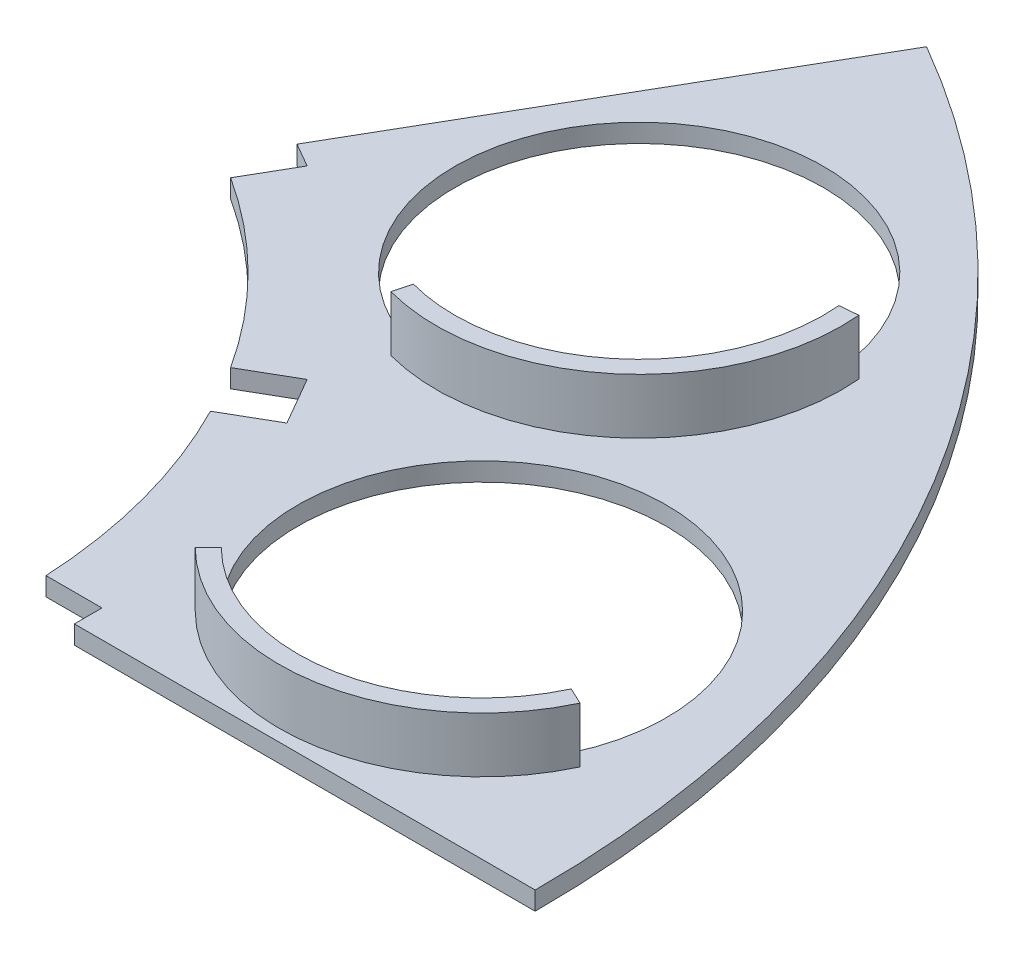
from build123d import *

# Parameters (mm, degrees)
AUFSATZ_LINEAR_AUSTRAGEN1_DEPTH = 5
SKIZZE2_R                       = 50
SCHNITT_LINEAR_AUSTRAGEN1_DEPTH = 384.666521865
AUFSATZ_LINEAR_START            = 15
AUFSATZ_LINEAR_AUSTRAGEN2_DEPTH = 15
SKIZZE4_R                       = 3.6
SCHNITT_LINEAR_AUSTRAGEN2_DEPTH = 4.4
SCHNITT_LINEAR_AUSTRAGEN3_DEPTH = 384.927076409


with BuildPart() as part:
    # Skizze1 → Aufsatz-Linear austragen1 (new body)
    with BuildSketch(Plane(origin=(0, 0, 0), x_dir=(1, 0, 0), z_dir=(0, 1, 0))):
        with BuildLine():
            Line((150, 0), (290, 0))
            ThreePointArc((290, 0), (251.147367097, 145), (145, 251.147367097))
            Line((145, 251.147367097), (75, 129.903810568))
            ThreePointArc((75, 129.903810568), (129.903810568, 75), (150, 0))
        make_face()
    extrude(amount=AUFSATZ_LINEAR_AUSTRAGEN1_DEPTH)

    # Skizze2 → Schnitt-Linear austragen1 (cut, through all)
    with BuildSketch(Plane(origin=(0, 5, 0), x_dir=(1, 0, 0), z_dir=(0, 1, 0))):
        with Locations(Location((217.333310915, 58.234285148, 0), (0, 0, 270))):
            Circle(SKIZZE2_R)
        with Locations(Location((159.099025767, 159.099025767, 0), (0, 0, 270))):
            Circle(SKIZZE2_R)
    extrude(amount=-SCHNITT_LINEAR_AUSTRAGEN1_DEPTH, mode=Mode.SUBTRACT)

    # Skizze3 → Aufsatz-Linear austragen2 (add)
    with BuildSketch(Plane(origin=(0, 5, 0), x_dir=(1, 0, 0), z_dir=(0, 1, 0)).offset(AUFSATZ_LINEAR_START)):
        with BuildLine():
            Line((146.158073512, 110.802734453), (144.863978286, 105.973105321))
            ThreePointArc((144.863978286, 105.973105321), (194.4523443, 116.966581395), (213.889734162, 163.892591618))
            Line((213.889734162, 163.892591618), (208.908760672, 163.456812904))
            ThreePointArc((208.908760672, 163.456812904), (191.238406251, 120.796803611), (146.158073512, 110.802734453))
        make_face()
        with BuildLine():
            Line((181.977971856, 22.878946089), (178.44243795, 19.343412183))
            ThreePointArc((178.44243795, 19.343412183), (226.883960687, 4.069858732), (267.180239202, 34.990280752))
            Line((267.180239202, 34.990280752), (262.648700267, 37.103372061))
            ThreePointArc((262.648700267, 37.103372061), (226.015719798, 8.993897497), (181.977971856, 22.878946089))
        make_face()
    extrude(amount=-AUFSATZ_LINEAR_AUSTRAGEN2_DEPTH)

    # Skizze4 → Schnitt-Linear austragen2 (cut)
    with BuildSketch(Plane.XZ):
        with Locations(Location((277.604561185, -36.547333822, 0), (0, 0, 270))):
            Circle(SKIZZE4_R)
        with Locations(Location((258.686269103, -107.151361062, 0), (0, 0, 270))):
            Circle(SKIZZE4_R)
        with Locations(Location((222.138935282, -170.453200122, 0), (0, 0, 270))):
            Circle(SKIZZE4_R)
        with Locations(Location((170.453200122, -222.138935282, 0), (0, 0, 270))):
            Circle(SKIZZE4_R)
        with Locations(Location((103.489442931, -134.87006785, 0), (0, 0, 270))):
            Circle(SKIZZE4_R)
        with Locations(Location((134.87006785, -103.489442931, 0), (0, 0, 270))):
            Circle(SKIZZE4_R)
        with Locations(Location((168.545626434, -22.189452677, 0), (0, 0, 270))):
            Circle(SKIZZE4_R)
        with Locations(Location((157.059520527, -65.056183502, 0), (0, 0, 270))):
            Circle(SKIZZE4_R)
    extrude(amount=-SCHNITT_LINEAR_AUSTRAGEN2_DEPTH, mode=Mode.SUBTRACT)

    # Skizze5 → Schnitt-Linear austragen3 (cut, through all)
    with BuildSketch(Plane(origin=(0, 5, 0), x_dir=(1, 0, 0), z_dir=(0, 1, 0))):
        with BuildLine():
            Line((75, 129.903810568), (82.5, 142.894191624))
            Line((82.5, 142.894191624), (88.995190528, 139.144191624))
            Line((88.995190528, 139.144191624), (81.401381861, 125.99132919))
            ThreePointArc((81.401381861, 125.99132919), (78.225155415, 127.987597291), (75, 129.903810568))
        make_face()
        with BuildLine():
            Line((150, 0), (165, 0))
            Line((165, 0), (165, 7.5))
            Line((165, 7.5), (149.812382666, 7.5))
            ThreePointArc((149.812382666, 7.5), (149.953088331, 3.751173159), (150, 0))
        make_face()
        with BuildLine():
            Line((125.99132919, 81.401381861), (139.144191624, 88.995190528))
            Line((139.144191624, 88.995190528), (146.644191624, 76.004809472))
            Line((146.644191624, 76.004809472), (133.49132919, 68.411000805))
            ThreePointArc((133.49132919, 68.411000805), (129.903810568, 75), (125.99132919, 81.401381861))
        make_face()
    extrude(amount=-SCHNITT_LINEAR_AUSTRAGEN3_DEPTH, mode=Mode.SUBTRACT)


solid = part.part
